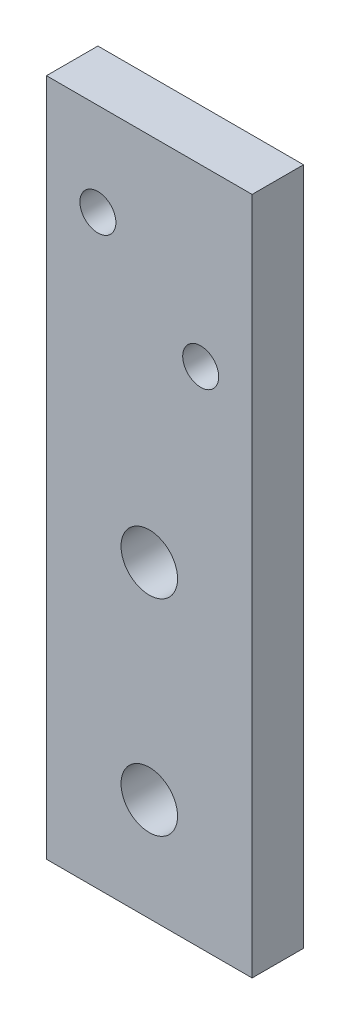
from build123d import *

# Parameters (mm, degrees)
ESQUISSE1_W        = 20
ESQUISSE1_H        = 66
ESQUISSE1_R        = 2.75
ESQUISSE1_R_2      = 1.75
BOSS_EXTRU_1_DEPTH = 5


with BuildPart() as part:
    # Esquisse1 → Boss.-Extru.1 (new body)
    with BuildSketch(Plane.XY):
        with Locations((-6.174697729, -8.108695652)):
            Rectangle(ESQUISSE1_W, ESQUISSE1_H)
        with Locations((-6.174697729, -31.108695652)):
            Circle(ESQUISSE1_R, mode=Mode.SUBTRACT)
        with Locations((-6.174697729, -11.108695652)):
            Circle(ESQUISSE1_R, mode=Mode.SUBTRACT)
        with Locations((-11.174697729, 15.891304348)):
            Circle(ESQUISSE1_R_2, mode=Mode.SUBTRACT)
        with Locations((-1.174697729, 7.891304348)):
            Circle(ESQUISSE1_R_2, mode=Mode.SUBTRACT)
    extrude(amount=BOSS_EXTRU_1_DEPTH)


solid = part.part
